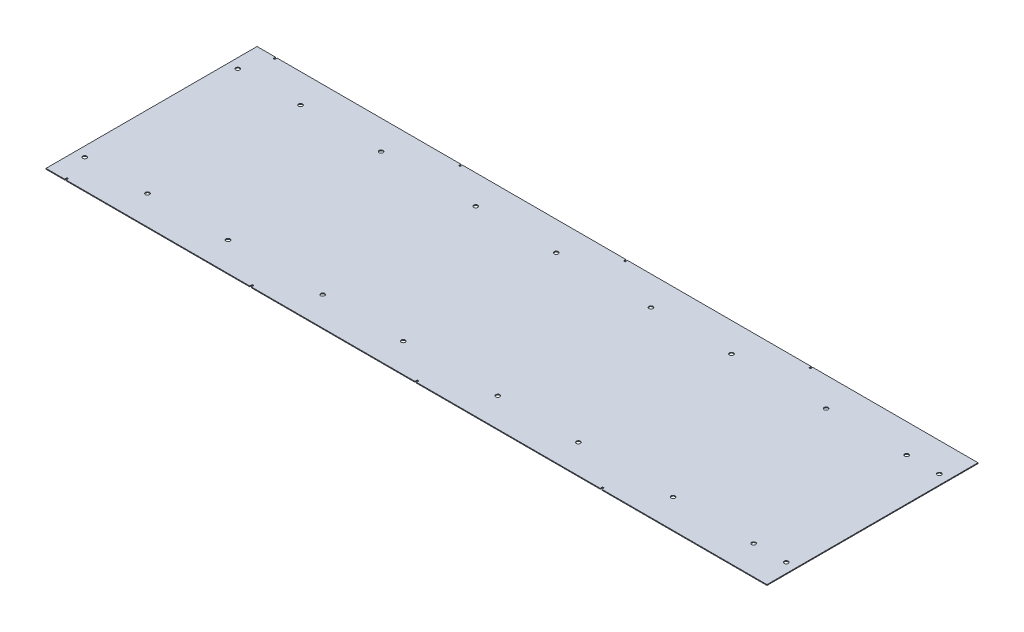
from build123d import *

# Parameters (mm, degrees)
SKETCH1_R           = 2.5
BOSS_EXTRUDE1_DEPTH = 1


with BuildPart() as part:
    # Sketch1 → Boss-Extrude1 (new body)
    with BuildSketch(Plane(origin=(0, 0, 0), x_dir=(1, 0, 0), z_dir=(0, 1, 0))):
        Polygon((0, 0), (23, 0), (23, 3), (25, 3), (25, 0), (253, 0), (253, 3), (255, 3), (255, 0), (458, 0), (458, 3), (460, 3), (460, 0), (688, 0), (688, 3), (690, 3), (690, 0), (895, 0), (895, 262), (690, 262), (690, 259), (688, 259), (688, 262), (460, 262), (460, 259), (458, 259), (458, 262), (255, 262), (255, 259), (253, 259), (253, 262), (25, 262), (25, 259), (23, 259), (23, 262), (0, 262), align=None)
        with Locations(Location((90, 226, 0), (0, 0, 270))):
            Circle(SKETCH1_R, mode=Mode.SUBTRACT)
        with Locations(Location((190, 226, 0), (0, 0, 270))):
            Circle(SKETCH1_R, mode=Mode.SUBTRACT)
        with Locations(Location((307.5, 226, 0), (0, 0, 270))):
            Circle(SKETCH1_R, mode=Mode.SUBTRACT)
        with Locations(Location((407.5, 226, 0), (0, 0, 270))):
            Circle(SKETCH1_R, mode=Mode.SUBTRACT)
        with Locations(Location((525, 226, 0), (0, 0, 270))):
            Circle(SKETCH1_R, mode=Mode.SUBTRACT)
        with Locations(Location((625, 226, 0), (0, 0, 270))):
            Circle(SKETCH1_R, mode=Mode.SUBTRACT)
        with Locations(Location((742.5, 226, 0), (0, 0, 270))):
            Circle(SKETCH1_R, mode=Mode.SUBTRACT)
        with Locations(Location((842.5, 226, 0), (0, 0, 270))):
            Circle(SKETCH1_R, mode=Mode.SUBTRACT)
        with Locations(Location((842.5, 36, 0), (0, 0, 270))):
            Circle(SKETCH1_R, mode=Mode.SUBTRACT)
        with Locations(Location((742.5, 36, 0), (0, 0, 270))):
            Circle(SKETCH1_R, mode=Mode.SUBTRACT)
        with Locations(Location((625, 36, 0), (0, 0, 270))):
            Circle(SKETCH1_R, mode=Mode.SUBTRACT)
        with Locations(Location((525, 36, 0), (0, 0, 270))):
            Circle(SKETCH1_R, mode=Mode.SUBTRACT)
        with Locations(Location((407.5, 36, 0), (0, 0, 270))):
            Circle(SKETCH1_R, mode=Mode.SUBTRACT)
        with Locations(Location((307.5, 36, 0), (0, 0, 270))):
            Circle(SKETCH1_R, mode=Mode.SUBTRACT)
        with Locations(Location((190, 36, 0), (0, 0, 270))):
            Circle(SKETCH1_R, mode=Mode.SUBTRACT)
        with Locations(Location((90, 36, 0), (0, 0, 270))):
            Circle(SKETCH1_R, mode=Mode.SUBTRACT)
        with Locations(Location((12, 36, 0), (0, 0, 270))):
            Circle(SKETCH1_R, mode=Mode.SUBTRACT)
        with Locations(Location((12, 226, 0), (0, 0, 270))):
            Circle(SKETCH1_R, mode=Mode.SUBTRACT)
        with Locations(Location((883, 226, 0), (0, 0, 270))):
            Circle(SKETCH1_R, mode=Mode.SUBTRACT)
        with Locations(Location((883, 36, 0), (0, 0, 270))):
            Circle(SKETCH1_R, mode=Mode.SUBTRACT)
    extrude(amount=BOSS_EXTRUDE1_DEPTH)


solid = part.part
